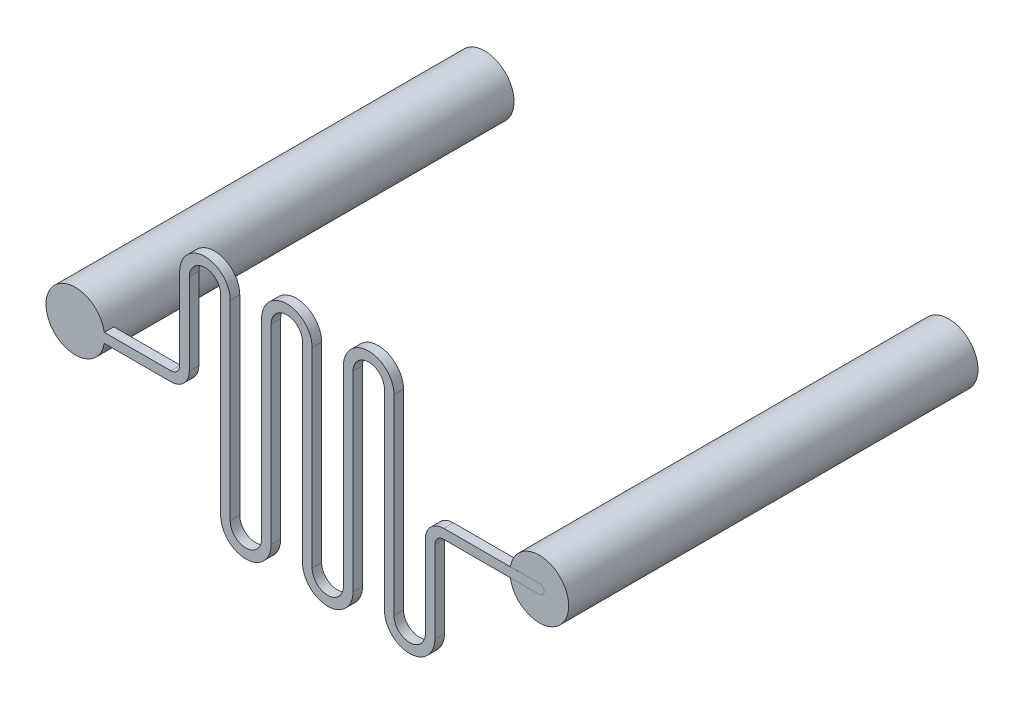
from build123d import *

# Parameters (mm, degrees)
BOSS_EXTRUDE1_DEPTH = 0.7
SKETCH3_W           = 2.15
SKETCH3_H           = 30
SKETCH4_W           = 2.15
SKETCH4_H           = 30
SKETCH5_R           = 1.75
CUT_EXTRUDE1_DEPTH  = 29


with BuildPart() as part:
    # Sketch2 → Boss-Extrude1 (new body)
    with BuildSketch(Plane.XY):
        with BuildLine():
            Line((-20.5, -0.35), (-13.5, -0.35))
            ThreePointArc((-13.5, -0.35), (-12.545405845, 0.045405845), (-12.15, 1))
            Line((-12.15, 1), (-12.15, 7))
            ThreePointArc((-12.15, 7), (-11, 8.15), (-9.85, 7))
            Line((-9.85, 7), (-9.85, 0))
            Line((-9.85, 0), (-9.85, -7))
            ThreePointArc((-9.85, -7), (-8, -8.85), (-6.15, -7))
            Line((-6.15, -7), (-6.15, 0))
            Line((-6.15, 0), (-6.15, 7))
            ThreePointArc((-6.15, 7), (-5, 8.15), (-3.85, 7))
            Line((-3.85, 7), (-3.85, 0))
            Line((-3.85, 0), (-3.85, -7))
            ThreePointArc((-3.85, -7), (-2, -8.85), (-0.15, -7))
            Line((-0.15, -7), (-0.15, 0))
            Line((-0.15, 0), (-0.15, 7))
            ThreePointArc((-0.15, 7), (1, 8.15), (2.15, 7))
            Line((2.15, 7), (2.15, 0))
            Line((2.15, 0), (2.15, -7))
            ThreePointArc((2.15, -7), (4, -8.85), (5.85, -7))
            Line((5.85, -7), (5.85, -1))
            ThreePointArc((5.85, -1), (6.040380592, -0.540380592), (6.5, -0.35))
            Line((6.5, -0.35), (13.5, -0.35))
            ThreePointArc((13.5, -0.35), (13.85, 0), (13.5, 0.35))
            Line((13.5, 0.35), (6.5, 0.35))
            ThreePointArc((6.5, 0.35), (5.545405845, -0.045405845), (5.15, -1))
            Line((5.15, -1), (5.15, -7))
            ThreePointArc((5.15, -7), (4, -8.15), (2.85, -7))
            Line((2.85, -7), (2.85, 0))
            Line((2.85, 0), (2.85, 7))
            ThreePointArc((2.85, 7), (1, 8.85), (-0.85, 7))
            Line((-0.85, 7), (-0.85, 0))
            Line((-0.85, 0), (-0.85, -7))
            ThreePointArc((-0.85, -7), (-2, -8.15), (-3.15, -7))
            Line((-3.15, -7), (-3.15, 0))
            Line((-3.15, 0), (-3.15, 7))
            ThreePointArc((-3.15, 7), (-5, 8.85), (-6.85, 7))
            Line((-6.85, 7), (-6.85, 0))
            Line((-6.85, 0), (-6.85, -7))
            ThreePointArc((-6.85, -7), (-8, -8.15), (-9.15, -7))
            Line((-9.15, -7), (-9.15, 0))
            Line((-9.15, 0), (-9.15, 7))
            ThreePointArc((-9.15, 7), (-11, 8.85), (-12.85, 7))
            Line((-12.85, 7), (-12.85, 1))
            ThreePointArc((-12.85, 1), (-13.040380592, 0.540380592), (-13.5, 0.35))
            Line((-13.5, 0.35), (-20.5, 0.35))
            ThreePointArc((-20.5, 0.35), (-20.85, 0), (-20.5, -0.35))
        make_face()
    extrude(amount=BOSS_EXTRUDE1_DEPTH)

    # Sketch3 → Revolve1 (revolve)
    with BuildSketch(Plane(origin=(0, 0, 0), x_dir=(1, 0, 0), z_dir=(0, 1, 0)), mode=Mode.PRIVATE) as revolve1_sk:
        with Locations((-21.575, 14.3)):
            Rectangle(SKETCH3_W, SKETCH3_H)
    revolve(revolve1_sk.sketch.rotate(Axis((-20.5, 0, 0.7), (0, 0, -1)), 180), axis=Axis((-20.5, 0, 0.7), (0, 0, -1)))

    # Sketch4 → Revolve2 (revolve)
    with BuildSketch(Plane(origin=(0, 0, 0), x_dir=(1, 0, 0), z_dir=(0, 1, 0))):
        with Locations((14.575, 14.30043177)):
            Rectangle(SKETCH4_W, SKETCH4_H)
    revolve(axis=Axis((13.5, 0, 0.69956823), (0, 0, -1)))

    # Sketch5 → Cut-Extrude1 (cut)
    with BuildSketch(Plane(origin=(0, 0, -29.3), x_dir=(-1, 0, 0), z_dir=(0, 0, -1))):
        with Locations((-13.5, 0)):
            Circle(SKETCH5_R)
        with Locations((20.5, 0)):
            Circle(SKETCH5_R)
    extrude(amount=-CUT_EXTRUDE1_DEPTH, mode=Mode.SUBTRACT)


solid = part.part
